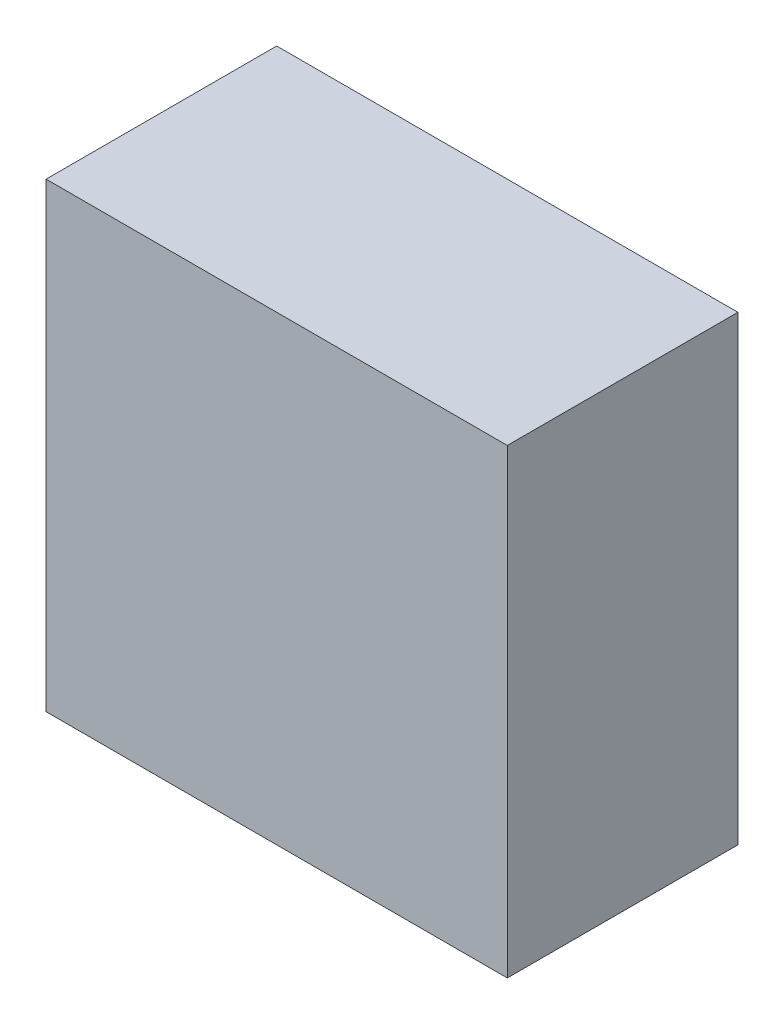
from build123d import *

# Parameters (mm, degrees)
SKETCH1_W           = 100
SKETCH1_H           = 100
BOSS_EXTRUDE1_DEPTH = 25


with BuildPart() as part:
    # Sketch1 → Boss-Extrude1 (new, symmetric)
    with BuildSketch(Plane.XY):
        Rectangle(SKETCH1_W, SKETCH1_H)
    extrude(amount=BOSS_EXTRUDE1_DEPTH, both=True)


solid = part.part
